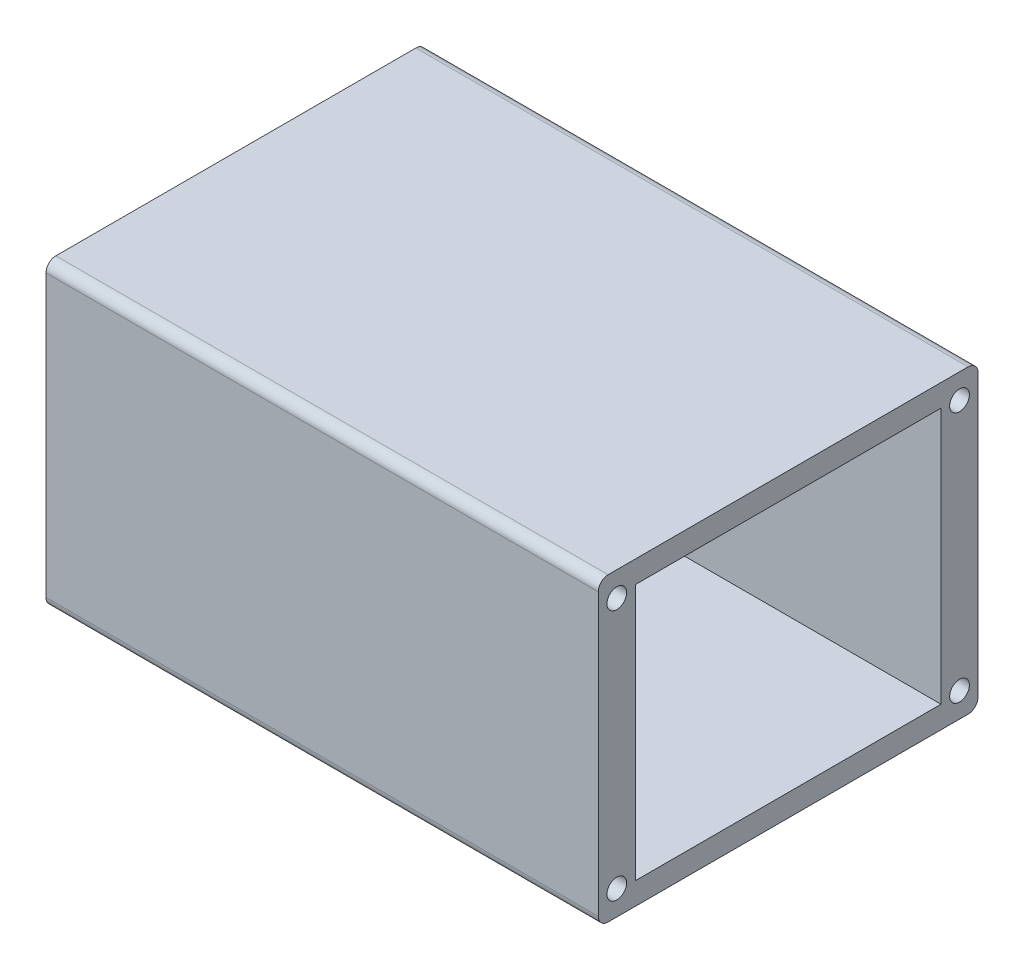
from build123d import *

# Parameters (mm, degrees)
CROQUIS1_W              = 77
CROQUIS1_H              = 61
SALIENTE_EXTRUIR1_DEPTH = 112
CROQUIS3_W              = 62
CROQUIS3_H              = 52
CORTAR_EXTRUIR4_DEPTH   = 110
CROQUIS10_R             = 2
CORTAR_EXTRUIR5_DEPTH   = 15
REDONDEO1_R             = 2
REDONDEO2_R             = 2


with BuildPart() as part:
    # Croquis1 → Saliente-Extruir1 (new body)
    with BuildSketch(Plane(origin=(0, 0, 0), x_dir=(0, 0, -1), z_dir=(1, 0, 0))):
        Rectangle(CROQUIS1_W, CROQUIS1_H)
    extrude(amount=SALIENTE_EXTRUIR1_DEPTH)

    # Croquis3 → Cortar-Extruir4 (cut)
    with BuildSketch(Plane(origin=(112, 0, 0), x_dir=(0, 0, -1), z_dir=(1, 0, 0))):
        Rectangle(CROQUIS3_W, CROQUIS3_H)
    extrude(amount=-CORTAR_EXTRUIR4_DEPTH, mode=Mode.SUBTRACT)

    # Croquis10 → Cortar-Extruir5 (cut)
    with BuildSketch(Plane(origin=(112, 0, 0), x_dir=(0, 0, -1), z_dir=(1, 0, 0))):
        with Locations((-34.75, 25.5)):
            Circle(CROQUIS10_R)
        with Locations((34.75, 25.5)):
            Circle(CROQUIS10_R)
        with Locations((34.75, -25.5)):
            Circle(CROQUIS10_R)
        with Locations((-34.75, -25.5)):
            Circle(CROQUIS10_R)
    extrude(amount=-CORTAR_EXTRUIR5_DEPTH, mode=Mode.SUBTRACT)

    # Redondeo1
    redondeo1_edges = [part.edges().sort_by_distance(p)[0] for p in [
        (56, 30.5, 38.5),
    ]]
    fillet(redondeo1_edges, radius=REDONDEO1_R)

    # Redondeo2
    redondeo2_edges = [part.edges().sort_by_distance(p)[0] for p in [
        (56, -30.5, -38.5),
        (56, -30.5, 38.5),
        (56, 30.5, -38.5),
    ]]
    fillet(redondeo2_edges, radius=REDONDEO2_R)


solid = part.part
